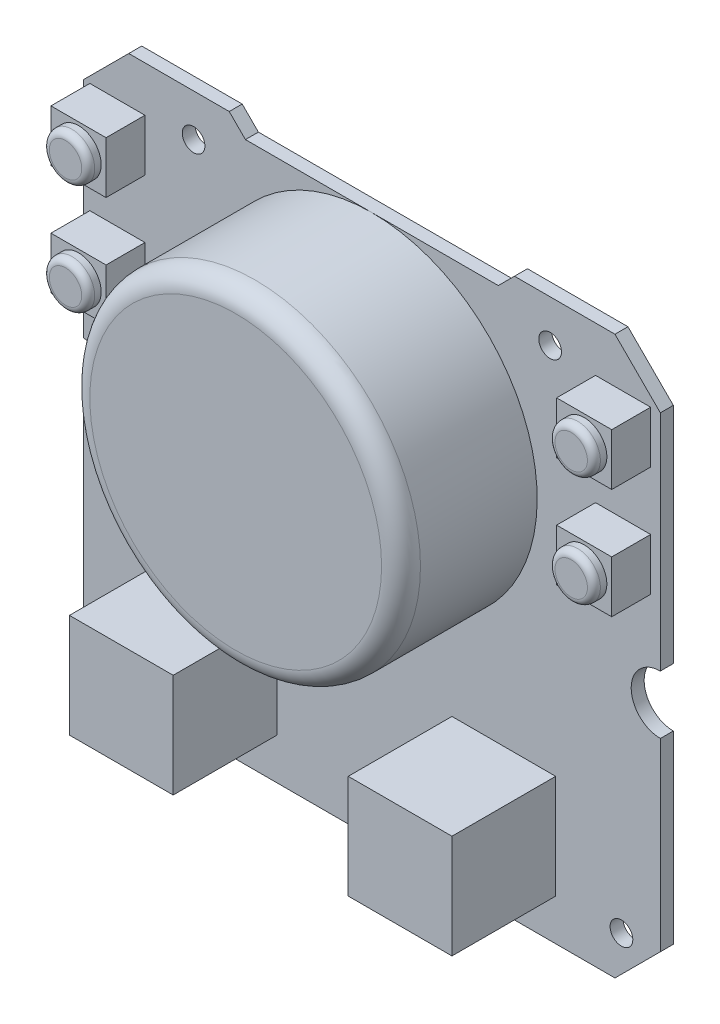
from build123d import *

# Parameters (mm, degrees)
BOSS_EXTRUDE1_DEPTH     = 2
SKETCH2_W               = 8.5
SKETCH2_H               = 8
BOSS_EXTRUDE2_DEPTH     = 6
SKETCH3_R               = 3.5
BOSS_EXTRUDE3_DEPTH     = 2
FILLET1_R               = 1
SKETCH4_R               = 25.5
BOSS_EXTRUDE4_DEPTH     = 21
FILLET2_R               = 3
SKETCH6_W               = 16
SKETCH6_H               = 16
BOSS_EXTRUDE5_DEPTH     = 16
CUT_EXTRUDE1_DEPTH      = 66.3471499
CUT_EXTRUDE1_DEPTH_BACK = 66.3471499
SKETCH7_R               = 1.75


with BuildPart() as part:
    # Sketch1 → Boss-Extrude1 (new body)
    with BuildSketch(Plane.XY):
        with BuildLine():
            Line((44.5, 36), (37.5, 43))
            Line((37.5, 43), (22, 43))
            Line((22, 43), (19.5, 40.5))
            Line((19.5, 40.5), (-19.5, 40.5))
            Line((-19.5, 40.5), (-22, 43))
            Line((-22, 43), (-37.5, 43))
            Line((-37.5, 43), (-44.5, 36))
            Line((-44.5, 36), (-44.5, 1.5))
            ThreePointArc((-44.5, 1.5), (-40, -3), (-44.5, -7.5))
            Line((-44.5, -7.5), (-44.5, -36))
            Line((-44.5, -36), (-37.5, -43))
            Line((-37.5, -43), (37.5, -43))
            Line((37.5, -43), (44.5, -36))
            Line((44.5, -36), (44.5, -7.5))
            ThreePointArc((44.5, -7.5), (40, -3), (44.5, 1.5))
            Line((44.5, 1.5), (44.5, 36))
        make_face()
    extrude(amount=-BOSS_EXTRUDE1_DEPTH)

    # Sketch2 → Boss-Extrude2 (add)
    with BuildSketch(Plane.XY):
        with Locations((-39.25, 32)):
            Rectangle(SKETCH2_W, SKETCH2_H)
        with Locations((38.75, 32)):
            Rectangle(SKETCH2_W, SKETCH2_H)
        with Locations((38.75, 15)):
            Rectangle(SKETCH2_W, SKETCH2_H)
        with Locations((-39.25, 15)):
            Rectangle(SKETCH2_W, SKETCH2_H)
    extrude(amount=BOSS_EXTRUDE2_DEPTH)

    # Sketch3 → Boss-Extrude3 (add)
    with BuildSketch(Plane.XY.offset(6)):
        with Locations((-39.25, 32)):
            Circle(SKETCH3_R)
        with Locations((38.75, 32)):
            Circle(SKETCH3_R)
        with Locations((38.75, 15)):
            Circle(SKETCH3_R)
        with Locations((-39.25, 15)):
            Circle(SKETCH3_R)
    extrude(amount=BOSS_EXTRUDE3_DEPTH)

    # Fillet1
    fillet1_edges = [part.edges().sort_by_distance(p)[0] for p in [
        (35.25, 32, 8),
        (35.25, 15, 8),
        (-42.75, 15, 8),
        (-42.75, 32, 8),
    ]]
    fillet(fillet1_edges, radius=FILLET1_R)

    # Sketch4 → Boss-Extrude4 (add)
    with BuildSketch(Plane.XY):
        with Locations(Location((0, 15, 0), (0, 0, 90))):
            Circle(SKETCH4_R)
    extrude(amount=BOSS_EXTRUDE4_DEPTH)

    # Fillet2
    fillet2_edges = [part.edges().sort_by_distance(p)[0] for p in [
        (0, -10.5, 21),
    ]]
    fillet(fillet2_edges, radius=FILLET2_R)

    # Sketch6 → Boss-Extrude5 (add)
    with BuildSketch(Plane.XY):
        with Locations((20.355257786, -28.630901536)):
            Rectangle(SKETCH6_W, SKETCH6_H)
        with Locations((-22.644742214, -28.630901536)):
            Rectangle(SKETCH6_W, SKETCH6_H)
    extrude(amount=BOSS_EXTRUDE5_DEPTH)

    # Sketch7 → Cut-Extrude1 (cut, two sides: drawn at the far end of the back side and taken through both)
    with BuildSketch(Plane.XY.offset(-CUT_EXTRUDE1_DEPTH_BACK)):
        with Locations((-27.5, 36.5)):
            Circle(SKETCH7_R)
        with Locations((27.5, 36.5)):
            Circle(SKETCH7_R)
        with Locations((-38, -36.5)):
            Circle(SKETCH7_R)
        with Locations((38.5, -36.5)):
            Circle(SKETCH7_R)
    extrude(amount=CUT_EXTRUDE1_DEPTH + CUT_EXTRUDE1_DEPTH_BACK, mode=Mode.SUBTRACT)


solid = part.part
